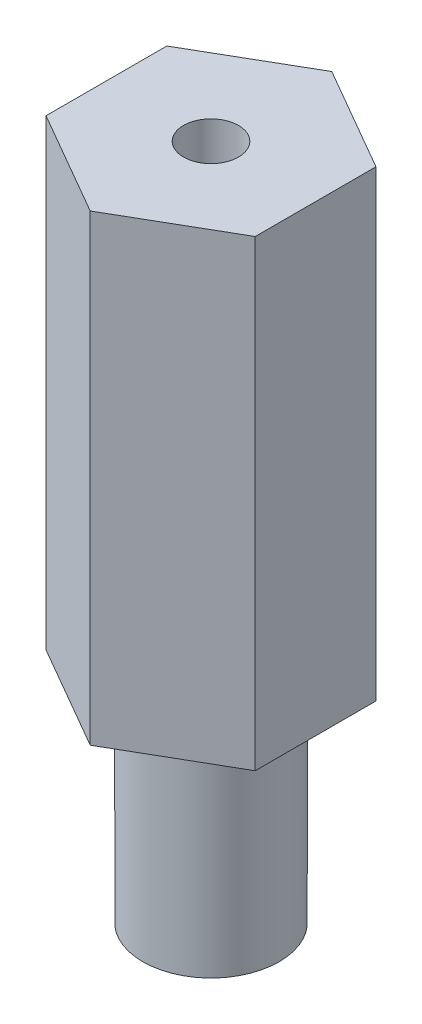
from build123d import *

# Parameters (mm, degrees)
BOSS_EXTRUDE1_DEPTH = 10
SKETCH2_R           = 1.4732
BOSS_EXTRUDE2_DEPTH = 4.6228
SKETCH3_R           = 0.593671867
CUT_EXTRUDE1_DEPTH  = 2.54


with BuildPart() as part:
    # Sketch1 → Boss-Extrude1 (new body)
    with BuildSketch(Plane(origin=(0, 0, 0), x_dir=(1, 0, 0), z_dir=(0, 1, 0))):
        Polygon((2.2606, 1.305158019), (0, 2.610316037), (-2.2606, 1.305158019), (-2.2606, -1.305158019), (0, -2.610316037), (2.2606, -1.305158019), align=None)
    extrude(amount=BOSS_EXTRUDE1_DEPTH)

    # Sketch2 → Boss-Extrude2 (add)
    with BuildSketch(Plane.XZ):
        with Locations(Location((0, 0, 0), (0, 0, 90))):
            Circle(SKETCH2_R)
    extrude(amount=BOSS_EXTRUDE2_DEPTH)

    # Sketch3 → Cut-Extrude1 (cut)
    with BuildSketch(Plane(origin=(0, 10, 0), x_dir=(1, 0, 0), z_dir=(0, 1, 0))):
        with Locations(Location((0, 0, 0), (0, 0, 270))):
            Circle(SKETCH3_R)
    extrude(amount=-CUT_EXTRUDE1_DEPTH, mode=Mode.SUBTRACT)


solid = part.part
